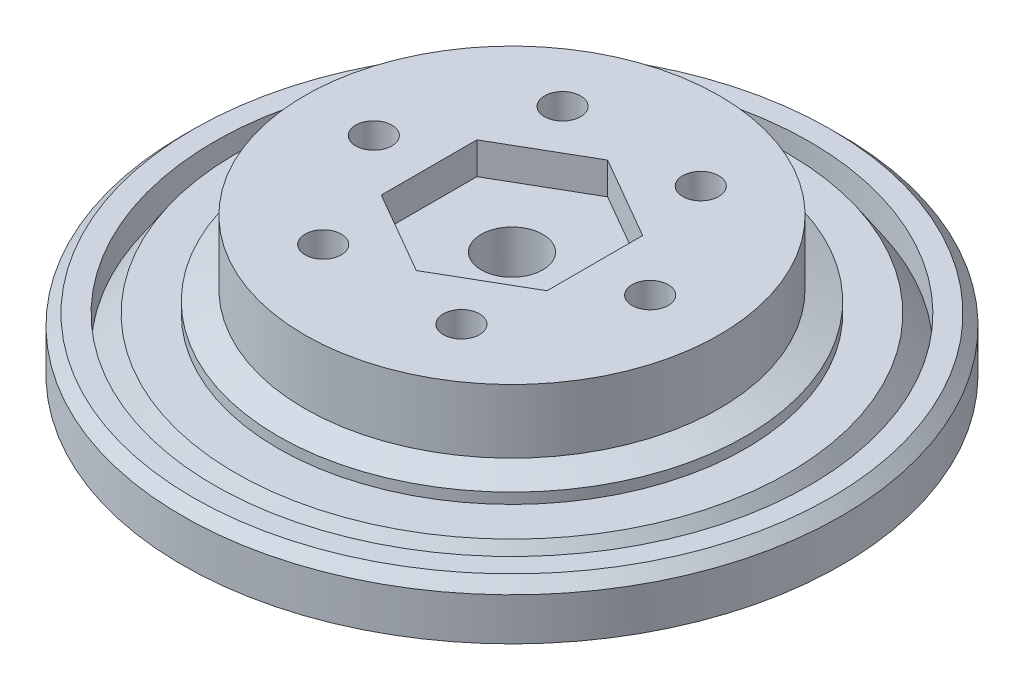
from build123d import *

# Parameters (mm, degrees)
CUT_EXTRUDE_1_DEPTH = 10
HOLE_WIZARD_M31_D   = 3.4
SKETCH_10_W         = 3
SKETCH_10_H         = 3
CHAMFER_3_SIZE      = 1
CUT_EXTRUDE_2_DEPTH = 3
HOLE_WIZARD_M51_D   = 5.8


with BuildPart() as part:
    # Эскиз2 → Повернуть1 (revolve)
    with BuildSketch(Plane.XY, mode=Mode.PRIVATE) as revolve_1_sk:
        Polygon((-19.5, 2), (-22, 1), (-22, 0), (0, 0), (0, 8), (-19.5, 8), align=None)
    revolve(revolve_1_sk.sketch.rotate(Axis((0, 8, 0), (0, -1, 0)), 270), axis=Axis((0, 8, 0), (0, -1, 0)))

    # Эскиз4 → Повернуть2 (revolve)
    with BuildSketch(Plane.XY, mode=Mode.PRIVATE) as revolve_2_sk:
        Polygon((0, 0), (26, 0), (28, -3), (31, -3), (31, -5), (0, -5), (0, -3), align=None)
    revolve(revolve_2_sk.sketch.rotate(Axis((0, -3, 0), (0, -1, 0)), 180), axis=Axis((0, -3, 0), (0, -1, 0)))

    # Эскиз6 → Вырез-Вытянуть1 (cut)
    with BuildSketch(Plane.XZ.offset(5)):
        Polygon((2.74722325, -11.258330249), (4.623611625, -14.508330249), (8.376388375, -14.508330249), (10.25277675, -11.258330249), (8.376388375, -8.008330249), (4.623611625, -8.008330249), align=None)
        Polygon((-10.25277675, -11.258330249), (-8.376388375, -14.508330249), (-4.623611625, -14.508330249), (-2.74722325, -11.258330249), (-4.623611625, -8.008330249), (-8.376388375, -8.008330249), align=None)
        Polygon((-16.75277675, 0), (-14.876388375, -3.25), (-11.123611625, -3.25), (-9.24722325, 0), (-11.123611625, 3.25), (-14.876388375, 3.25), align=None)
        Polygon((-10.25277675, 11.258330249), (-8.376388375, 8.008330249), (-4.623611625, 8.008330249), (-2.74722325, 11.258330249), (-4.623611625, 14.508330249), (-8.376388375, 14.508330249), align=None)
        Polygon((2.74722325, 11.258330249), (4.623611625, 8.008330249), (8.376388375, 8.008330249), (10.25277675, 11.258330249), (8.376388375, 14.508330249), (4.623611625, 14.508330249), align=None)
        Polygon((9.24722325, 0), (11.123611625, -3.25), (14.876388375, -3.25), (16.75277675, 0), (14.876388375, 3.25), (11.123611625, 3.25), align=None)
    extrude(amount=-CUT_EXTRUDE_1_DEPTH, mode=Mode.SUBTRACT)

    # Отверстие с зазором M31 (through all)
    with Locations(Plane(origin=(0, 5, 0), x_dir=(-1, 0, 0), z_dir=(0, -1, 0))):
        with Locations((6.5, -11.258330249), (13, 0), (6.5, 11.258330249), (-6.5, 11.258330249), (-13, 0), (-6.5, -11.258330249)):
            Hole(HOLE_WIZARD_M31_D / 2)

    # Эскиз10 → Повернуть3 (revolve)
    with BuildSketch(Plane.XY, mode=Mode.PRIVATE) as revolve_3_sk:
        with Locations((-29.5, -1.5)):
            Rectangle(SKETCH_10_W, SKETCH_10_H)
    revolve(revolve_3_sk.sketch.rotate(Axis((0, -2.994452998, 0), (0, 1, 0)), 270), axis=Axis((0, -2.994452998, 0), (0, 1, 0)))

    # Фаска3
    chamfer_3_edges = [part.edges().sort_by_distance(p)[0] for p in [
        (0, 0, 31),
    ]]
    chamfer(chamfer_3_edges, length=CHAMFER_3_SIZE)

    # Эскиз11 → Вырез-Вытянуть2 (cut)
    with BuildSketch(Plane(origin=(0, 8, 0), x_dir=(1, 0, 0), z_dir=(0, 1, 0))):
        Polygon((7.794228634, -4.5), (7.794228634, 4.5), (0, 9), (-7.794228634, 4.5), (-7.794228634, -4.5), (0, -9), align=None)
    extrude(amount=-CUT_EXTRUDE_2_DEPTH, mode=Mode.SUBTRACT)

    # Отверстие с зазором M51 (through all)
    with Locations(Plane(origin=(0, -5, 0), x_dir=(-1, 0, 0), z_dir=(0, -1, 0))):
        with Locations((0, 0)):
            Hole(HOLE_WIZARD_M51_D / 2)


solid = part.part
